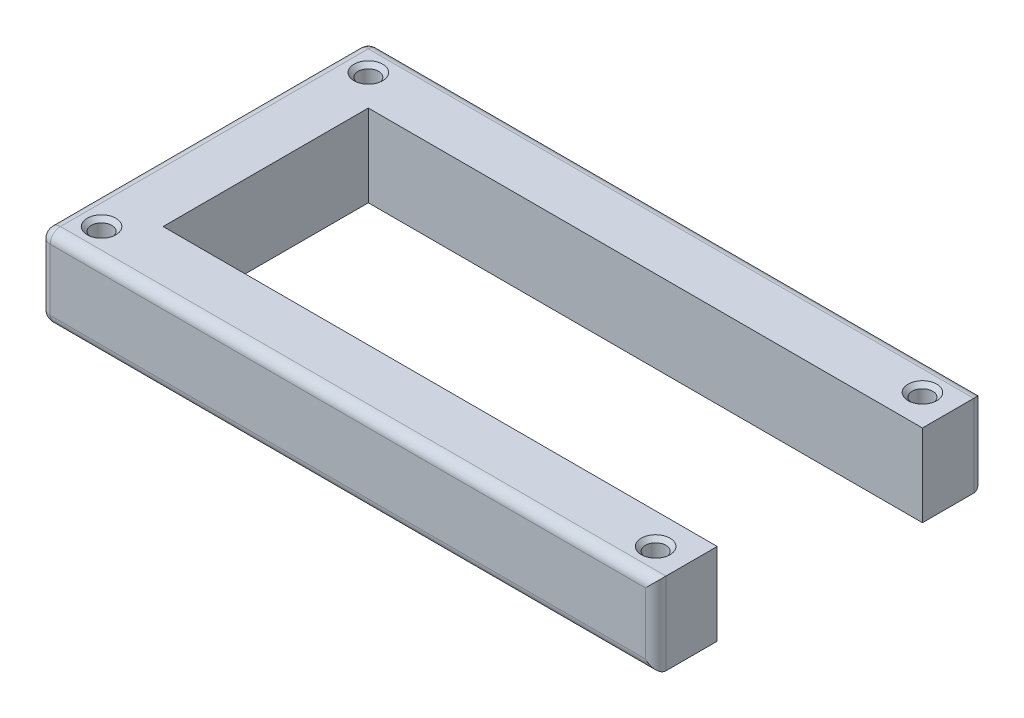
from build123d import *

# Parameters (mm, degrees)
SKETCH1_R           = 2.5
BOSS_EXTRUDE1_DEPTH = 20
FILLET1_R           = 2.5
CHAMFER1_SIZE       = 1


with BuildPart() as part:
    # Sketch1 → Boss-Extrude1 (new body)
    with BuildSketch(Plane(origin=(0, 0, 0), x_dir=(1, 0, 0), z_dir=(0, 1, 0))):
        Polygon((75, 25), (75, 40), (-75, 40), (-75, -40), (75, -40), (75, -25), (-60, -25), (-60, 25), align=None)
        with Locations(Location((-67.5, 32.5, 0), (0, 0, 270))):
            Circle(SKETCH1_R, mode=Mode.SUBTRACT)
        with Locations(Location((67.5, -32.5, 0), (0, 0, 270))):
            Circle(SKETCH1_R, mode=Mode.SUBTRACT)
        with Locations(Location((-67.5, -32.5, 0), (0, 0, 270))):
            Circle(SKETCH1_R, mode=Mode.SUBTRACT)
        with Locations(Location((67.5, 32.5, 0), (0, 0, 270))):
            Circle(SKETCH1_R, mode=Mode.SUBTRACT)
    extrude(amount=BOSS_EXTRUDE1_DEPTH)

    # Fillet1
    fillet1_edges = [part.edges().sort_by_distance(p)[0] for p in [
        (0, 0, 40),
        (-75, 0, 0),
        (-75, 10, -40),
        (75, 10, -40),
        (75, 10, 40),
        (-75, 10, 40),
        (0, 20, -40),
        (-75, 20, 0),
        (0, 0, -40),
        (0, 20, 40),
    ]]
    fillet(fillet1_edges, radius=FILLET1_R)

    # Chamfer1
    chamfer1_edges = [part.edges().sort_by_distance(p)[0] for p in [
        (-67.5, 20, -35),
        (67.5, 20, -35),
        (67.5, 20, 30),
        (-67.5, 20, 30),
    ]]
    chamfer(chamfer1_edges, length=CHAMFER1_SIZE)


solid = part.part
